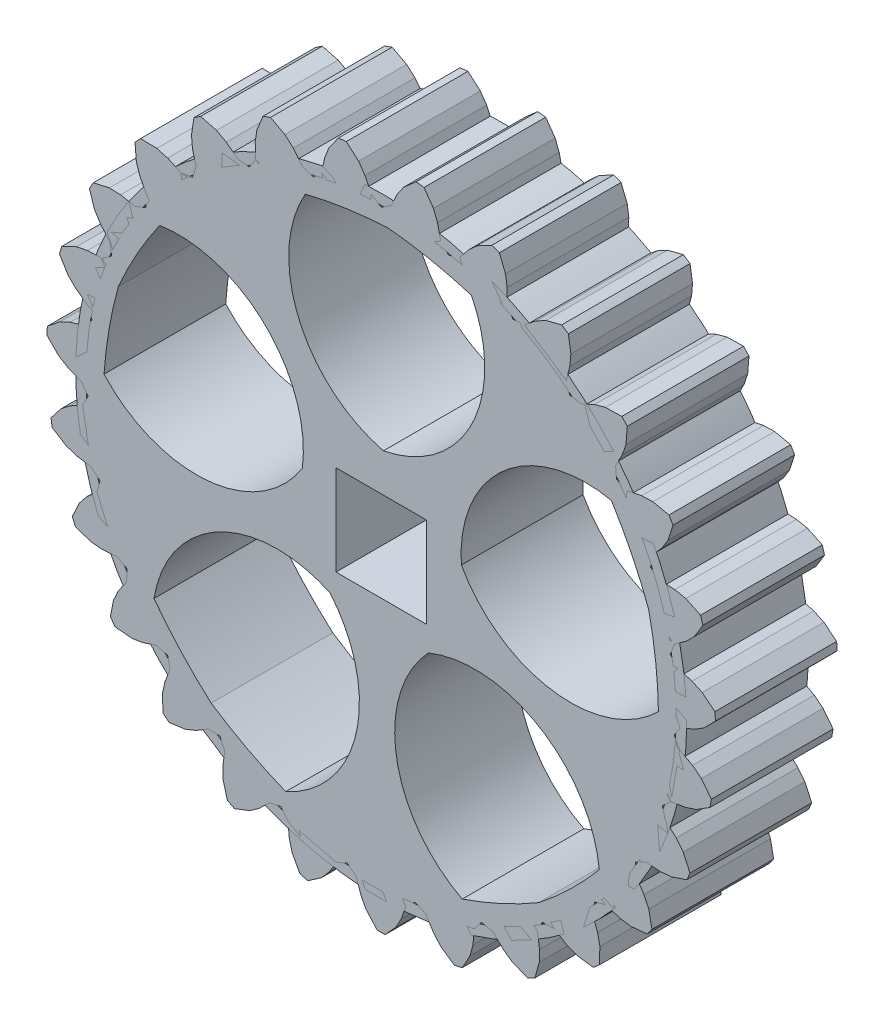
from build123d import *

# Parameters (mm, degrees)
SKETCH1_R           = 27.5
SKETCH1_W           = 7.424621202
SKETCH1_H           = 7.424621202
BOSS_EXTRUDE1_DEPTH = 10
CUT_EXTRUDE1_DEPTH  = 41.155946011
CIRPATTERN1_COUNT   = 27
CUT_EXTRUDE2_DEPTH  = 41.135815882
SKETCH5_R           = 25.109802293
SKETCH5_R_2         = 24.249619568
BOSS_EXTRUDE2_DEPTH = 10
CIRPATTERN2_COUNT   = 5
CHAMFER1_SIZE       = 0.5


with BuildPart() as part:
    # Sketch1 → Boss-Extrude1 (new body)
    with BuildSketch(Plane.XY):
        Circle(SKETCH1_R)
        Rectangle(SKETCH1_W, SKETCH1_H, mode=Mode.SUBTRACT)
    extrude(amount=BOSS_EXTRUDE1_DEPTH)

    # Sketch2 → Cut-Extrude1 (cut, through all)
    with BuildSketch(Plane.XY):
        Polygon((0, 24.120567986), (-0.806852748, 24.618927596), (-1.329964738, 25.708744241), (-1.855743872, 26.464350449), (-2.866453658, 27.350200062), (-1.855743872, 28.122731928), (0, 28.718651877), (1.855743872, 28.122731928), (2.866453658, 27.350200062), (1.855743872, 26.464350449), (1.329964738, 25.708744241), (0.806852748, 24.618927596), align=None)
    cut_extrude1 = extrude(amount=CUT_EXTRUDE1_DEPTH, mode=Mode.SUBTRACT)

    # CirPattern1: Cut-Extrude1 ×27 about axis
    cirpattern1_axis = Axis((0, 0, 0), (0, 0, 1))
    for i in range(1, CIRPATTERN1_COUNT):
        add(cut_extrude1.rotate(cirpattern1_axis, i * 360 / CIRPATTERN1_COUNT), mode=Mode.SUBTRACT)

    # Sketch4 → Cut-Extrude2 (cut, symmetric)
    with BuildSketch(Plane.XY):
        with BuildLine():
            ThreePointArc((0.187190222, 6.867541283), (-6.769169462, 12.795825389), (-6.236882725, 21.920087733))
            ThreePointArc((-6.236882725, 21.920087733), (-2.831382802, 22.589334199), (0.624450923, 22.909543239))
            ThreePointArc((0.624450923, 22.909543239), (4.057710317, 22.401556533), (7.421697179, 21.54779254))
            ThreePointArc((7.421697179, 21.54779254), (7.456158425, 12.40808221), (0.187190222, 6.867541283))
        make_face()
    cut_extrude2 = extrude(amount=CUT_EXTRUDE2_DEPTH, both=True, mode=Mode.SUBTRACT)

    # CirPattern2: Cut-Extrude2 ×5 about axis
    cirpattern2_axis = Axis((0, 0, 0), (0, 0, 1))
    for i in range(1, CIRPATTERN2_COUNT):
        add(cut_extrude2.rotate(cirpattern2_axis, i * 360 / CIRPATTERN2_COUNT), mode=Mode.SUBTRACT)

    # Chamfer1
    chamfer1_edges = [part.edges().sort_by_distance(p)[0] for p in [
        (-3.712310601, 0, 0),
        (0, -3.712310601, 0),
        (3.712310601, 0, 0),
        (0, 3.712310601, 0),
    ]]
    chamfer(chamfer1_edges, length=CHAMFER1_SIZE)


with BuildPart() as body_2:
    # Sketch5 → Boss-Extrude2 (new body)
    with BuildSketch(Plane.XY):
        Circle(SKETCH5_R)
        Circle(SKETCH5_R_2, mode=Mode.SUBTRACT)
    extrude(amount=BOSS_EXTRUDE2_DEPTH)


solid = Compound([part.part, body_2.part])
